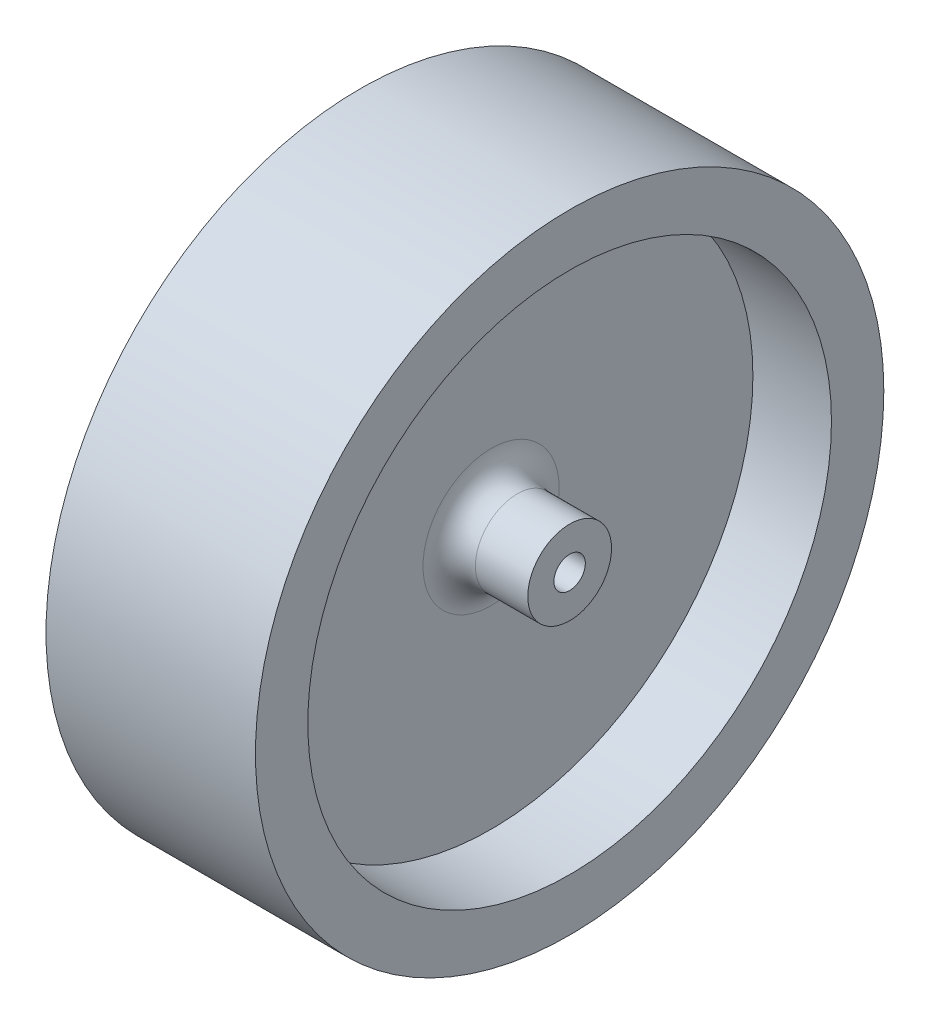
from build123d import *

# Parameters (mm, degrees)
SKETCH2_R           = 60
BOSS_EXTRUDE1_DEPTH = 40
SKETCH3_R           = 50
CUT_EXTRUDE1_DEPTH  = 15
CUT_EXTRUDE2_START  = -15
SKETCH4_R           = 50
CUT_EXTRUDE2_DEPTH  = 15
SKETCH5_R           = 8
BOSS_EXTRUDE2_DEPTH = 15
BOSS_EXTRUDE3_START = 15
SKETCH6_R           = 8
BOSS_EXTRUDE3_DEPTH = 15
SKETCH7_R           = 3
CUT_EXTRUDE3_DEPTH  = 40
FILLET2_R           = 5


with BuildPart() as part:
    # Sketch2 → Boss-Extrude1 (new body)
    with BuildSketch(Plane(origin=(0, 0, 0), x_dir=(0, 0, -1), z_dir=(1, 0, 0))):
        Circle(SKETCH2_R)
    extrude(amount=BOSS_EXTRUDE1_DEPTH)

    # Sketch3 → Cut-Extrude1 (cut)
    with BuildSketch(Plane(origin=(40, 0, 0), x_dir=(0, 0, -1), z_dir=(1, 0, 0))):
        Circle(SKETCH3_R)
    extrude(amount=-CUT_EXTRUDE1_DEPTH, mode=Mode.SUBTRACT)

    # Sketch4 → Cut-Extrude2 (cut)
    with BuildSketch(Plane.ZY.offset(CUT_EXTRUDE2_START)):
        with Locations(Location((0, 0, 0), (0, 0, 180))):
            Circle(SKETCH4_R)
    extrude(amount=CUT_EXTRUDE2_DEPTH, mode=Mode.SUBTRACT)

    # Sketch5 → Boss-Extrude2 (add)
    with BuildSketch(Plane.ZY.offset(-15)):
        Circle(SKETCH5_R)
    extrude(amount=BOSS_EXTRUDE2_DEPTH)

    # Sketch6 → Boss-Extrude3 (add)
    with BuildSketch(Plane(origin=(25, 0, 0), x_dir=(0, 0, -1), z_dir=(1, 0, 0)).offset(BOSS_EXTRUDE3_START)):
        with Locations(Location((0, 0, 0), (0, 0, 180))):
            Circle(SKETCH6_R)
    extrude(amount=-BOSS_EXTRUDE3_DEPTH)

    # Sketch7 → Cut-Extrude3 (cut)
    with BuildSketch(Plane(origin=(40, 0, 0), x_dir=(0, 0, -1), z_dir=(1, 0, 0))):
        Circle(SKETCH7_R)
    extrude(amount=-CUT_EXTRUDE3_DEPTH, mode=Mode.SUBTRACT)

    # Fillet2
    fillet2_edges = [part.edges().sort_by_distance(p)[0] for p in [
        (15, 0, -8),
        (25, 0, -8),
    ]]
    fillet(fillet2_edges, radius=FILLET2_R)


solid = part.part
